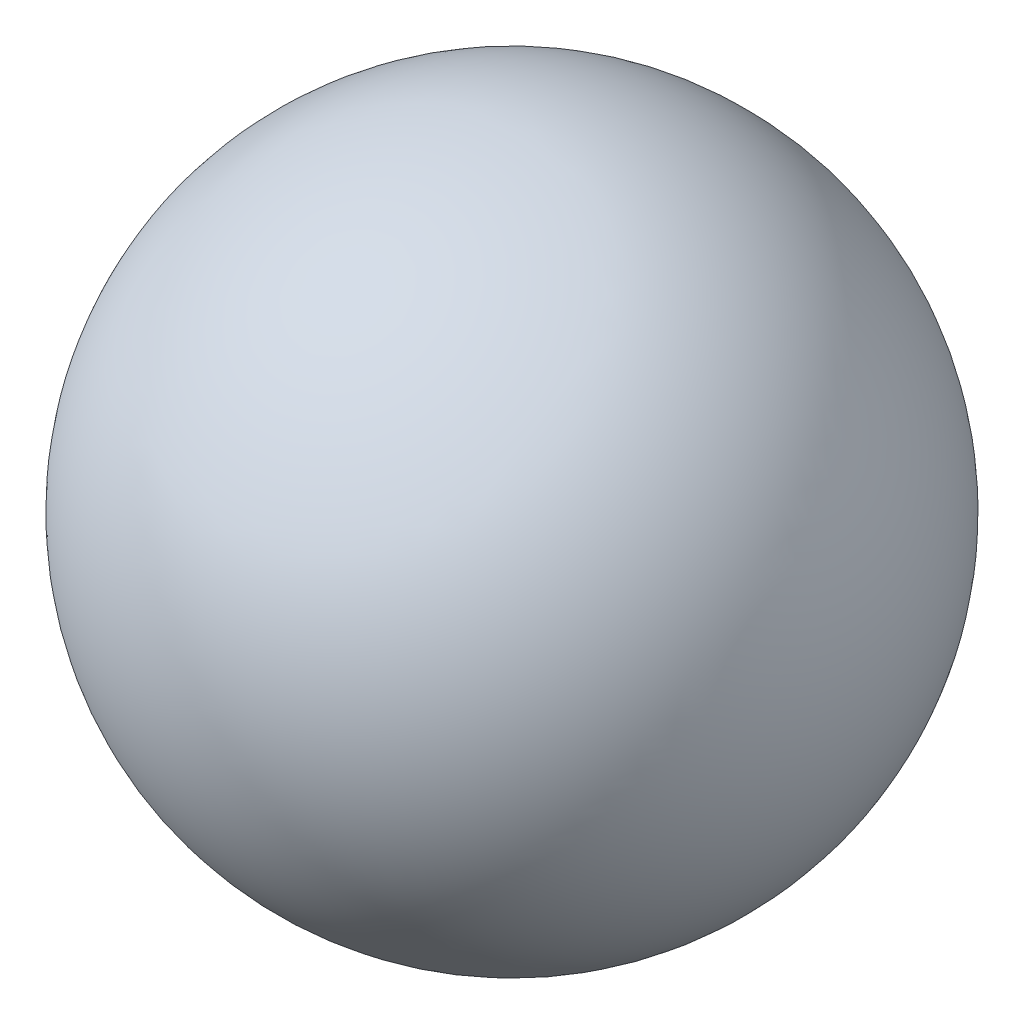
from build123d import *


with BuildPart() as part:
    # Sketch1 → Revolve1 (revolve)
    with BuildSketch(Plane.XY):
        with BuildLine():
            Line((-16, 0), (16, 0))
            ThreePointArc((16, 0), (0, -16), (-16, 0))
        make_face()
    revolve(axis=Axis((-16, 0, 0), (1, 0, 0)))


solid = part.part
